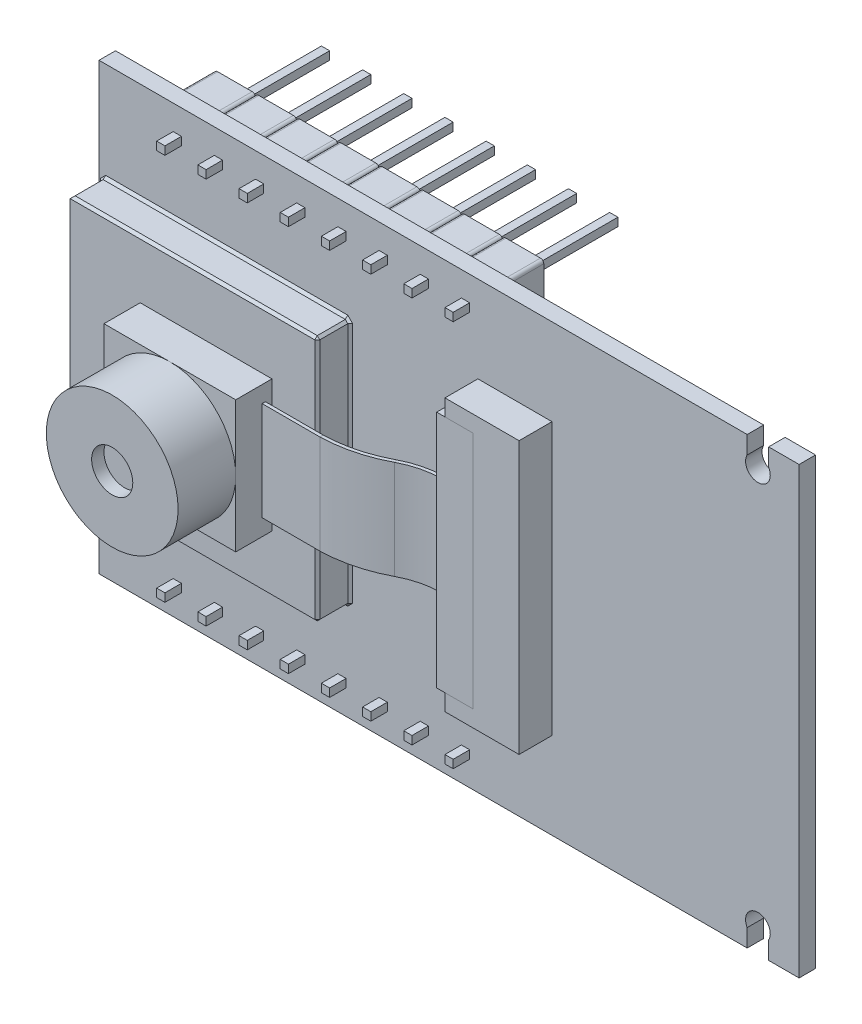
from build123d import *

# Parameters (mm, degrees)
BOSS_EXTRUDE1_DEPTH      = 1
SKETCH2_W                = 15
SKETCH2_H                = 15
BOSS_EXTRUDE2_DEPTH      = 2
SKETCH3_W                = 0.75
SKETCH3_H                = 11.5
CUT_EXTRUDE1_DEPTH       = 7.5
BOSS_EXTRUDE3_DEPTH      = 3
CHAMFER2_SIZE            = 0.15
SKETCH6_W                = 25
SKETCH6_H                = 18
BOSS_EXTRUDE4_DEPTH      = 1
SKETCH7_W                = 2.3
SKETCH7_H                = 2.3
BOSS_EXTRUDE5_DEPTH      = 0.15
SKETCH8_R                = 0.95
SKETCH8_R_2              = 0.9
SKETCH8_R_3              = 0.175
BOSS_EXTRUDE6_DEPTH      = 0.6
BOSS_EXTRUDE7_DEPTH      = 2.5
BOSS_EXTRUDE8_DEPTH      = 5.5
BOSS_EXTRUDE8_DEPTH_BACK = 4.5
SKETCH10_W               = 0.5
SKETCH10_H               = 0.5
SKETCH11_W               = 4.5
SKETCH11_H               = 16.5
SKETCH11_W_2             = 2.2
SKETCH11_H_2             = 14.5
BOSS_EXTRUDE9_DEPTH      = 2
SKETCH13_W               = 8
SKETCH13_H               = 8
BOSS_EXTRUDE12_DEPTH     = 2.2
SKETCH14_R               = 4
SKETCH14_R_2             = 1.25
BOSS_EXTRUDE13_DEPTH     = 3.5
SKETCH15_R               = 1.25
BOSS_EXTRUDE14_DEPTH     = 2.75
SKETCH17_W               = 0.2
SKETCH17_H               = 6


with BuildPart() as part:
    # Sketch1 → Boss-Extrude1 (new body)
    with BuildSketch(Plane.XY):
        with BuildLine():
            Line((-21.25, -13.5), (18.1, -13.5))
            Line((18.1, -13.5), (18.1, -12.424165739))
            ThreePointArc((18.1, -12.424165739), (18.75, -11.3), (19.4, -12.424165739))
            Line((19.4, -12.424165739), (19.4, -13.5))
            Line((19.4, -13.5), (21.25, -13.5))
            Line((21.25, -13.5), (21.25, 13.5))
            Line((21.25, 13.5), (19.4, 13.5))
            Line((19.4, 13.5), (19.4, 12.424165739))
            ThreePointArc((19.4, 12.424165739), (18.75, 11.3), (18.1, 12.424165739))
            Line((18.1, 12.424165739), (18.1, 13.5))
            Line((18.1, 13.5), (-21.25, 13.5))
            Line((-21.25, 13.5), (-21.25, -13.5))
        make_face()
    extrude(amount=BOSS_EXTRUDE1_DEPTH)

    # Sketch2 → Boss-Extrude2 (add)
    with BuildSketch(Plane.XY.offset(1)):
        with Locations((-13.5, 0)):
            Rectangle(SKETCH2_W, SKETCH2_H)
    extrude(amount=BOSS_EXTRUDE2_DEPTH)

    # Sketch3 → Cut-Extrude1 (cut)
    with BuildSketch(Plane.ZY.offset(21)):
        with Locations((2.425, 0.65)):
            Rectangle(SKETCH3_W, SKETCH3_H)
    extrude(amount=-CUT_EXTRUDE1_DEPTH, mode=Mode.SUBTRACT)

    # Sketch4 → Boss-Extrude3 (add)
    with BuildSketch(Plane(origin=(0, 0, 0), x_dir=(-1, 0, 0), z_dir=(0, 0, -1))):
        Polygon((-11.25, 2.25), (-11.25, -7.75), (5.75, -7.75), (5.75, 7.75), (-8.5, 7.75), (-8.5, 2.25), align=None)
    extrude(amount=BOSS_EXTRUDE3_DEPTH)

    # Chamfer2
    chamfer2_edges = [part.edges().sort_by_distance(p)[0] for p in [
        (-21, 0, 1),
        (-21, 7.5, 2),
        (-13.5, -7.5, 1),
        (-21, -7.5, 2),
        (-6, 0, 1),
        (-6, -7.5, 2),
        (-13.5, 7.5, 1),
        (-6, 7.5, 2),
        (-13.5, -7.5, 3),
        (-6, 0, 3),
        (-13.5, 7.5, 3),
    ]]
    chamfer(chamfer2_edges, length=CHAMFER2_SIZE)

    # Sketch6 → Boss-Extrude4 (add)
    with BuildSketch(Plane(origin=(0, 0, 0), x_dir=(-1, 0, 0), z_dir=(0, 0, -1))):
        with Locations((-6.25, 0)):
            Rectangle(SKETCH6_W, SKETCH6_H)
    extrude(amount=BOSS_EXTRUDE4_DEPTH)

    # Sketch7 → Boss-Extrude5 (add)
    with BuildSketch(Plane(origin=(0, 0, -1), x_dir=(-1, 0, 0), z_dir=(0, 0, -1))):
        with Locations((-10.1, 6.6)):
            Rectangle(SKETCH7_W, SKETCH7_H)
    extrude(amount=BOSS_EXTRUDE5_DEPTH)

    # Sketch8 → Boss-Extrude6 (add)
    # profile 1 of 2: a face of its own
    with BuildSketch(Plane(origin=(0, 0, -1.15), x_dir=(-1, 0, 0), z_dir=(0, 0, -1))):
        with Locations((-10.1, 6.6)):
            Circle(SKETCH8_R)
        with Locations((-10.1, 6.6)):
            Circle(SKETCH8_R_2, mode=Mode.SUBTRACT)
    # profile 2 of 2: a face of its own
    with BuildSketch(Plane(origin=(0, 0, -1.15), x_dir=(-1, 0, 0), z_dir=(0, 0, -1))):
        with Locations((-10.1, 6.6)):
            Circle(SKETCH8_R_3)
    extrude(amount=BOSS_EXTRUDE6_DEPTH)

    # Sketch9 → Boss-Extrude7 (add)
    with BuildSketch(Plane(origin=(0, 0, 0), x_dir=(-1, 0, 0), z_dir=(0, 0, -1))):
        with BuildLine():
            Line((15.45, -13), (17.55, -13))
            ThreePointArc((17.55, -13), (17.691421356, -12.941421356), (17.75, -12.8))
            Line((17.75, -12.8), (17.75, -10.7))
            ThreePointArc((17.75, -10.7), (17.691421356, -10.558578644), (17.55, -10.5))
            Line((17.55, -10.5), (15.45, -10.5))
            ThreePointArc((15.45, -10.5), (15.308578644, -10.558578644), (15.25, -10.7))
            ThreePointArc((15.25, -10.7), (15.191421356, -10.558578644), (15.05, -10.5))
            Line((15.05, -10.5), (12.95, -10.5))
            ThreePointArc((12.95, -10.5), (12.808578644, -10.558578644), (12.75, -10.7))
            ThreePointArc((12.75, -10.7), (12.691421356, -10.558578644), (12.55, -10.5))
            Line((12.55, -10.5), (10.45, -10.5))
            ThreePointArc((10.45, -10.5), (10.308578644, -10.558578644), (10.25, -10.7))
            ThreePointArc((10.25, -10.7), (10.191421356, -10.558578644), (10.05, -10.5))
            Line((10.05, -10.5), (7.95, -10.5))
            ThreePointArc((7.95, -10.5), (7.808578644, -10.558578644), (7.75, -10.7))
            ThreePointArc((7.75, -10.7), (7.691421356, -10.558578644), (7.55, -10.5))
            Line((7.55, -10.5), (5.45, -10.5))
            ThreePointArc((5.45, -10.5), (5.308578644, -10.558578644), (5.25, -10.7))
            ThreePointArc((5.25, -10.7), (5.191421356, -10.558578644), (5.05, -10.5))
            Line((5.05, -10.5), (2.95, -10.5))
            ThreePointArc((2.95, -10.5), (2.808578644, -10.558578644), (2.75, -10.7))
            ThreePointArc((2.75, -10.7), (2.691421356, -10.558578644), (2.55, -10.5))
            Line((2.55, -10.5), (0.45, -10.5))
            ThreePointArc((0.45, -10.5), (0.308578644, -10.558578644), (0.25, -10.7))
            ThreePointArc((0.25, -10.7), (0.191421356, -10.558578644), (0.05, -10.5))
            Line((0.05, -10.5), (-2.05, -10.5))
            ThreePointArc((-2.05, -10.5), (-2.191421356, -10.558578644), (-2.25, -10.7))
            Line((-2.25, -10.7), (-2.25, -12.8))
            ThreePointArc((-2.25, -12.8), (-2.191421356, -12.941421356), (-2.05, -13))
            Line((-2.05, -13), (0.05, -13))
            ThreePointArc((0.05, -13), (0.191421356, -12.941421356), (0.25, -12.8))
            ThreePointArc((0.25, -12.8), (0.308578644, -12.941421356), (0.45, -13))
            Line((0.45, -13), (2.55, -13))
            ThreePointArc((2.55, -13), (2.691421356, -12.941421356), (2.75, -12.8))
            ThreePointArc((2.75, -12.8), (2.808578644, -12.941421356), (2.95, -13))
            Line((2.95, -13), (5.05, -13))
            ThreePointArc((5.05, -13), (5.191421356, -12.941421356), (5.25, -12.8))
            ThreePointArc((5.25, -12.8), (5.308578644, -12.941421356), (5.45, -13))
            Line((5.45, -13), (7.55, -13))
            ThreePointArc((7.55, -13), (7.691421356, -12.941421356), (7.75, -12.8))
            ThreePointArc((7.75, -12.8), (7.808578644, -12.941421356), (7.95, -13))
            Line((7.95, -13), (10.05, -13))
            ThreePointArc((10.05, -13), (10.191421356, -12.941421356), (10.25, -12.8))
            ThreePointArc((10.25, -12.8), (10.308578644, -12.941421356), (10.45, -13))
            Line((10.45, -13), (12.55, -13))
            ThreePointArc((12.55, -13), (12.691421356, -12.941421356), (12.75, -12.8))
            ThreePointArc((12.75, -12.8), (12.808578644, -12.941421356), (12.95, -13))
            Line((12.95, -13), (15.05, -13))
            ThreePointArc((15.05, -13), (15.191421356, -12.941421356), (15.25, -12.8))
            ThreePointArc((15.25, -12.8), (15.308578644, -12.941421356), (15.45, -13))
        make_face()
        with BuildLine():
            Line((-2.05, 10.5), (0.05, 10.5))
            ThreePointArc((0.05, 10.5), (0.191421356, 10.558578644), (0.25, 10.7))
            ThreePointArc((0.25, 10.7), (0.308578644, 10.558578644), (0.45, 10.5))
            Line((0.45, 10.5), (2.55, 10.5))
            ThreePointArc((2.55, 10.5), (2.691421356, 10.558578644), (2.75, 10.7))
            ThreePointArc((2.75, 10.7), (2.808578644, 10.558578644), (2.95, 10.5))
            Line((2.95, 10.5), (5.05, 10.5))
            ThreePointArc((5.05, 10.5), (5.191421356, 10.558578644), (5.25, 10.7))
            ThreePointArc((5.25, 10.7), (5.308578644, 10.558578644), (5.45, 10.5))
            Line((5.45, 10.5), (7.55, 10.5))
            ThreePointArc((7.55, 10.5), (7.691421356, 10.558578644), (7.75, 10.7))
            ThreePointArc((7.75, 10.7), (7.808578644, 10.558578644), (7.95, 10.5))
            Line((7.95, 10.5), (10.05, 10.5))
            ThreePointArc((10.05, 10.5), (10.191421356, 10.558578644), (10.25, 10.7))
            ThreePointArc((10.25, 10.7), (10.308578644, 10.558578644), (10.45, 10.5))
            Line((10.45, 10.5), (12.55, 10.5))
            ThreePointArc((12.55, 10.5), (12.691421356, 10.558578644), (12.75, 10.7))
            ThreePointArc((12.75, 10.7), (12.808578644, 10.558578644), (12.95, 10.5))
            Line((12.95, 10.5), (15.05, 10.5))
            ThreePointArc((15.05, 10.5), (15.191421356, 10.558578644), (15.25, 10.7))
            ThreePointArc((15.25, 10.7), (15.308578644, 10.558578644), (15.45, 10.5))
            Line((15.45, 10.5), (17.55, 10.5))
            ThreePointArc((17.55, 10.5), (17.691421356, 10.558578644), (17.75, 10.7))
            Line((17.75, 10.7), (17.75, 12.8))
            ThreePointArc((17.75, 12.8), (17.691421356, 12.941421356), (17.55, 13))
            Line((17.55, 13), (15.45, 13))
            ThreePointArc((15.45, 13), (15.308578644, 12.941421356), (15.25, 12.8))
            ThreePointArc((15.25, 12.8), (15.191421356, 12.941421356), (15.05, 13))
            Line((15.05, 13), (12.95, 13))
            ThreePointArc((12.95, 13), (12.808578644, 12.941421356), (12.75, 12.8))
            ThreePointArc((12.75, 12.8), (12.691421356, 12.941421356), (12.55, 13))
            Line((12.55, 13), (10.45, 13))
            ThreePointArc((10.45, 13), (10.308578644, 12.941421356), (10.25, 12.8))
            ThreePointArc((10.25, 12.8), (10.191421356, 12.941421356), (10.05, 13))
            Line((10.05, 13), (7.95, 13))
            ThreePointArc((7.95, 13), (7.808578644, 12.941421356), (7.75, 12.8))
            ThreePointArc((7.75, 12.8), (7.691421356, 12.941421356), (7.55, 13))
            Line((7.55, 13), (5.45, 13))
            ThreePointArc((5.45, 13), (5.308578644, 12.941421356), (5.25, 12.8))
            ThreePointArc((5.25, 12.8), (5.191421356, 12.941421356), (5.05, 13))
            Line((5.05, 13), (2.95, 13))
            ThreePointArc((2.95, 13), (2.808578644, 12.941421356), (2.75, 12.8))
            ThreePointArc((2.75, 12.8), (2.691421356, 12.941421356), (2.55, 13))
            Line((2.55, 13), (0.45, 13))
            ThreePointArc((0.45, 13), (0.308578644, 12.941421356), (0.25, 12.8))
            ThreePointArc((0.25, 12.8), (0.191421356, 12.941421356), (0.05, 13))
            Line((0.05, 13), (-2.05, 13))
            ThreePointArc((-2.05, 13), (-2.191421356, 12.941421356), (-2.25, 12.8))
            Line((-2.25, 12.8), (-2.25, 10.7))
            ThreePointArc((-2.25, 10.7), (-2.191421356, 10.558578644), (-2.05, 10.5))
        make_face()
    extrude(amount=BOSS_EXTRUDE7_DEPTH)

    # Sketch10 → Boss-Extrude8 (add, two sides: drawn at the far end of the back side and taken through both)
    with BuildSketch(Plane(origin=(0, 0, -2.5), x_dir=(-1, 0, 0), z_dir=(0, 0, -1)).offset(-BOSS_EXTRUDE8_DEPTH_BACK)):
        with Locations((-1, -11.75)):
            Rectangle(SKETCH10_W, SKETCH10_H)
        with Locations((1.5, -11.75)):
            Rectangle(SKETCH10_W, SKETCH10_H)
        with Locations((4, -11.75)):
            Rectangle(SKETCH10_W, SKETCH10_H)
        with Locations((6.5, -11.75)):
            Rectangle(SKETCH10_W, SKETCH10_H)
        with Locations((9, -11.75)):
            Rectangle(SKETCH10_W, SKETCH10_H)
        with Locations((11.5, -11.75)):
            Rectangle(SKETCH10_W, SKETCH10_H)
        with Locations((14, -11.75)):
            Rectangle(SKETCH10_W, SKETCH10_H)
        with Locations((16.5, -11.75)):
            Rectangle(SKETCH10_W, SKETCH10_H)
        with Locations((16.5, 11.75)):
            Rectangle(SKETCH10_W, SKETCH10_H)
        with Locations((14, 11.75)):
            Rectangle(SKETCH10_W, SKETCH10_H)
        with Locations((11.5, 11.75)):
            Rectangle(SKETCH10_W, SKETCH10_H)
        with Locations((9, 11.75)):
            Rectangle(SKETCH10_W, SKETCH10_H)
        with Locations((6.5, 11.75)):
            Rectangle(SKETCH10_W, SKETCH10_H)
        with Locations((4, 11.75)):
            Rectangle(SKETCH10_W, SKETCH10_H)
        with Locations((1.5, 11.75)):
            Rectangle(SKETCH10_W, SKETCH10_H)
        with Locations((-1, 11.75)):
            Rectangle(SKETCH10_W, SKETCH10_H)
    extrude(amount=BOSS_EXTRUDE8_DEPTH + BOSS_EXTRUDE8_DEPTH_BACK)

    # Sketch11 → Boss-Extrude9 (add)
    with BuildSketch(Plane.XY.offset(1)):
        with Locations((4, 0)):
            Rectangle(SKETCH11_W, SKETCH11_H)
        with Locations((2.35, 0)):
            Rectangle(SKETCH11_W_2, SKETCH11_H_2)
    extrude(amount=BOSS_EXTRUDE9_DEPTH)

    # Sketch13 → Boss-Extrude12 (add)
    with BuildSketch(Plane.XY.offset(3)):
        with Locations((-12.75, 0)):
            Rectangle(SKETCH13_W, SKETCH13_H)
    extrude(amount=BOSS_EXTRUDE12_DEPTH)

    # Sketch14 → Boss-Extrude13 (add)
    with BuildSketch(Plane.XY.offset(5.2)):
        with Locations((-12.75, 0)):
            Circle(SKETCH14_R)
        with Locations((-12.75, 0)):
            Circle(SKETCH14_R_2, mode=Mode.SUBTRACT)
    extrude(amount=BOSS_EXTRUDE13_DEPTH)

    # Sketch15 → Boss-Extrude14 (add)
    with BuildSketch(Plane.XY.offset(5.2)):
        with Locations((-12.75, 0)):
            Circle(SKETCH15_R)
    extrude(amount=BOSS_EXTRUDE14_DEPTH)

    # Sweep1: sweep along a path in Sketch16
    with BuildLine(Plane.XZ.offset(13.5)) as sweep1_path:
        Line((1.25, 2), (0.649487544, 2))
        ThreePointArc((0.649487544, 2), (-0.552268397, 2.146570011), (-1.683567785, 2.577686937))
        ThreePointArc((-1.683567785, 2.577686937), (-3.407248986, 3.245569568), (-5.238207546, 3.5))
        Line((-5.238207546, 3.5), (-8.75, 3.5))
    # Sketch17 → Sweep1 (sweep)
    with BuildSketch(Plane.ZY.offset(-1.25)):
        with Locations((2, 0)):
            Rectangle(SKETCH17_W, SKETCH17_H)
    sweep(path=sweep1_path.line, transition=Transition.RIGHT)


solid = part.part
